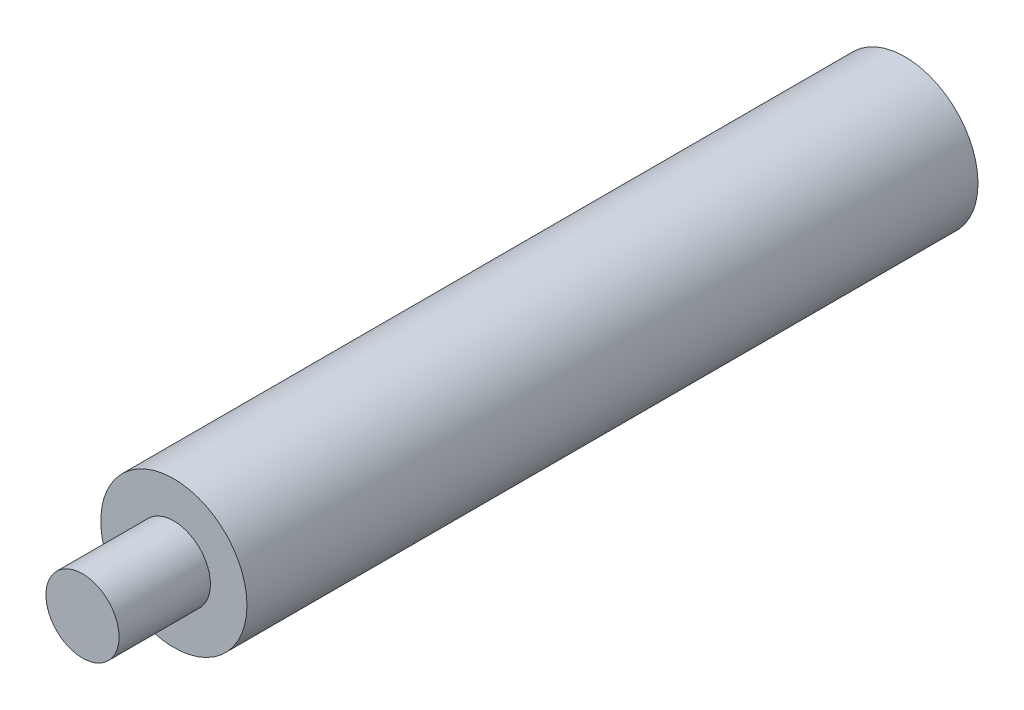
from build123d import *

# Parameters (mm, degrees)
SKETCH1_R           = 40
BOSS_EXTRUDE1_DEPTH = 400
SKETCH2_R           = 20
BOSS_EXTRUDE2_DEPTH = 50


with BuildPart() as part:
    # Sketch1 → Boss-Extrude1 (new body)
    with BuildSketch(Plane.XY):
        Circle(SKETCH1_R)
    extrude(amount=BOSS_EXTRUDE1_DEPTH)

    # Sketch2 → Boss-Extrude2 (add)
    with BuildSketch(Plane.XY.offset(400)):
        Circle(SKETCH2_R)
    extrude(amount=BOSS_EXTRUDE2_DEPTH)


solid = part.part
